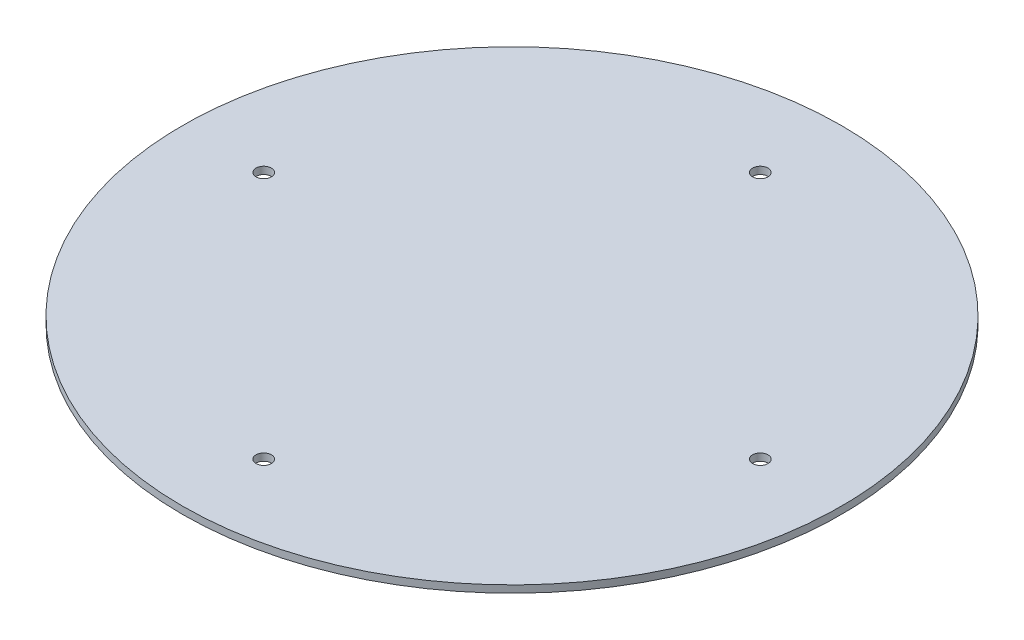
from build123d import *

# Parameters (mm, degrees)
BOSS_EXTRUDE1_DEPTH  = 1.6
M3_CLEARANCE_HOLE1_D = 3.4


with BuildPart() as part:
    # Sketch1 → Boss-Extrude1 (new body)
    with BuildSketch(Plane(origin=(0, 0, 0), x_dir=(1, 0, 0), z_dir=(0, 1, 0))):
        with BuildLine():
            ThreePointArc((-65, 33.226495452), (-73, 0), (-65, -33.226495452))
            ThreePointArc((-65, -33.226495452), (-51.618795027, -51.618795027), (-33.226495452, -65))
            ThreePointArc((-33.226495452, -65), (0, -73), (33.226495452, -65))
            ThreePointArc((33.226495452, -65), (51.618795027, -51.618795027), (65, -33.226495452))
            ThreePointArc((65, -33.226495452), (70.971825396, -17.088007491), (73, 0))
            ThreePointArc((73, 0), (70.971825396, 17.088007491), (65, 33.226495452))
            ThreePointArc((65, 33.226495452), (51.618795027, 51.618795027), (33.226495452, 65))
            ThreePointArc((33.226495452, 65), (0, 73), (-33.226495452, 65))
            ThreePointArc((-33.226495452, 65), (-51.618795027, 51.618795027), (-65, 33.226495452))
        make_face()
    extrude(amount=BOSS_EXTRUDE1_DEPTH)

    # M3 Clearance Hole1 (through all)
    with Locations(Plane(origin=(0, 1.6, 0), x_dir=(1, 0, 0), z_dir=(0, 1, 0))):
        with Locations((0, 55), (55, 0), (-55, 0), (0, -55)):
            Hole(M3_CLEARANCE_HOLE1_D / 2)


solid = part.part
